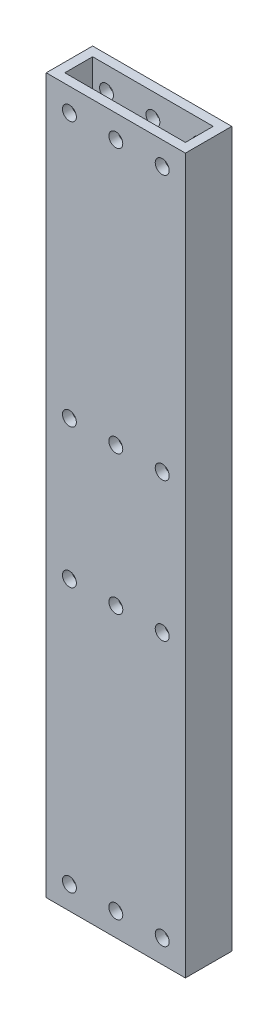
from build123d import *

# Parameters (mm, degrees)
SKETCH_1_W          = 30
SKETCH_1_H          = 10
SKETCH_1_W_2        = 26
SKETCH_1_H_2        = 6
EXTRUDE_1_DEPTH     = 77
SKETCH_2_R          = 1.5
CUT_EXTRUDE_1_DEPTH = 80.082235679


with BuildPart() as part:
    # 草图1 → 凸台-拉伸1 (new, symmetric)
    with BuildSketch(Plane(origin=(0, 0, 0), x_dir=(1, 0, 0), z_dir=(0, 1, 0))):
        Rectangle(SKETCH_1_W, SKETCH_1_H)
        Rectangle(SKETCH_1_W_2, SKETCH_1_H_2, mode=Mode.SUBTRACT)
    extrude(amount=EXTRUDE_1_DEPTH, both=True)

    # 草图2 → 切除-拉伸1 (cut, through all)
    with BuildSketch(Plane.XY.offset(5)):
        with Locations((10, 15)):
            Circle(SKETCH_2_R)
        with Locations((-10, 15)):
            Circle(SKETCH_2_R)
        with Locations((0, 15)):
            Circle(SKETCH_2_R)
        with Locations(Location((10, -15, 0), (0, 0, 180))):
            Circle(SKETCH_2_R)
        with Locations(Location((0, -15, 0), (0, 0, 180))):
            Circle(SKETCH_2_R)
        with Locations(Location((-10, -15, 0), (0, 0, 180))):
            Circle(SKETCH_2_R)
        with Locations((10, 72)):
            Circle(SKETCH_2_R)
        with Locations((-10, 72)):
            Circle(SKETCH_2_R)
        with Locations((0, 72)):
            Circle(SKETCH_2_R)
        with Locations(Location((-10, -72, 0), (0, 0, 180))):
            Circle(SKETCH_2_R)
        with Locations(Location((0, -72, 0), (0, 0, 180))):
            Circle(SKETCH_2_R)
        with Locations(Location((10, -72, 0), (0, 0, 180))):
            Circle(SKETCH_2_R)
    extrude(amount=-CUT_EXTRUDE_1_DEPTH, mode=Mode.SUBTRACT)


solid = part.part
